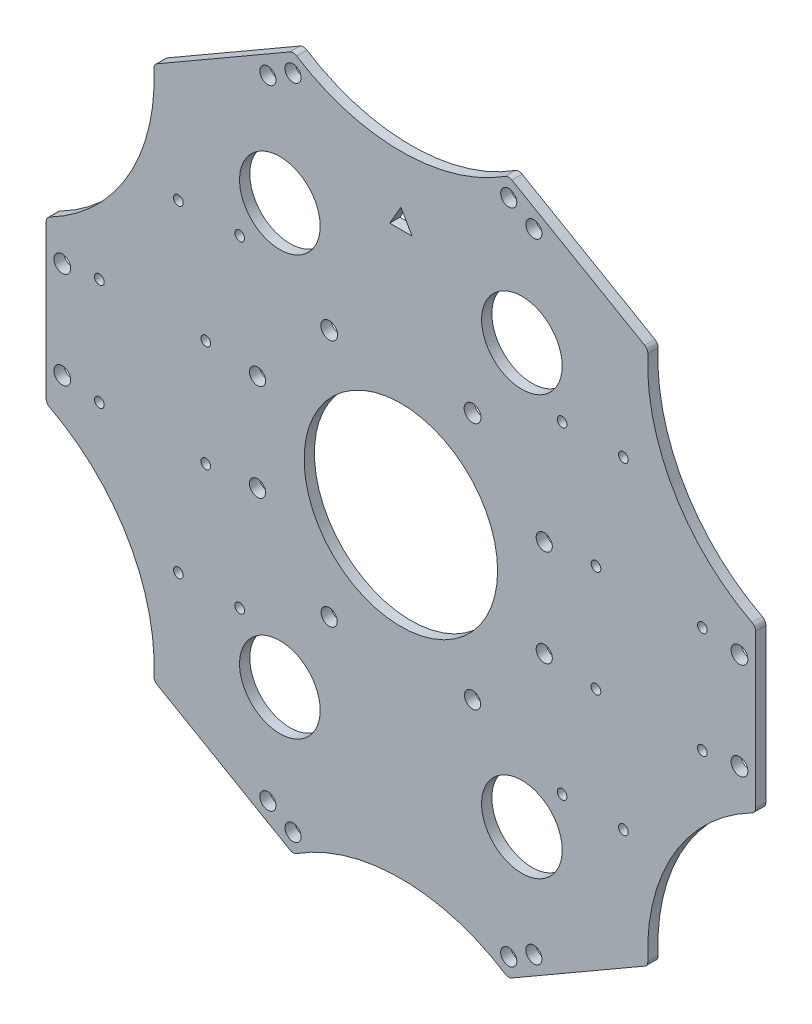
from build123d import *

# Parameters (mm, degrees)
SKETCH1_R           = 2.5
SKETCH1_R_2         = 2.6
SKETCH1_R_3         = 1.5
SKETCH1_R_4         = 12.5
SKETCH1_R_5         = 30
BOSS_EXTRUDE1_DEPTH = 3.175
FILLET1_R           = 2
SKETCH3_R           = 1.5
CUT_EXTRUDE1_DEPTH  = 4


with BuildPart() as part:
    # Sketch1 → Boss-Extrude1 (new body)
    with BuildSketch(Plane.XY):
        with BuildLine():
            Line((-120, -25), (-120, 25))
            ThreePointArc((-120, 25), (-94.559451613, 48.820422151), (-86.650635095, 82.762794416))
            Line((-86.650635095, 82.762794416), (-43.349364905, 107.762794416))
            ThreePointArc((-43.349364905, 107.762794416), (-10, 97.640844302), (23.349364905, 107.762794416))
            Line((23.349364905, 107.762794416), (66.650635095, 82.762794416))
            ThreePointArc((66.650635095, 82.762794416), (74.559451613, 48.820422151), (100, 25))
            Line((100, 25), (100, -25))
            ThreePointArc((100, -25), (74.559451613, -48.820422151), (66.650635095, -82.762794416))
            Line((66.650635095, -82.762794416), (23.349364905, -107.762794416))
            ThreePointArc((23.349364905, -107.762794416), (-10, -97.640844302), (-43.349364905, -107.762794416))
            Line((-43.349364905, -107.762794416), (-86.650635095, -82.762794416))
            ThreePointArc((-86.650635095, -82.762794416), (-94.559451613, -48.820422151), (-120, -25))
        make_face()
        with Locations((12.227985364, -38.5)):
            Circle(SKETCH1_R, mode=Mode.SUBTRACT)
        with Locations((-54.455970728, 15)):
            Circle(SKETCH1_R, mode=Mode.SUBTRACT)
        with Locations((12.227985364, 38.5)):
            Circle(SKETCH1_R_2, mode=Mode.SUBTRACT)
        with Locations((-32.227985364, 38.5)):
            Circle(SKETCH1_R_2, mode=Mode.SUBTRACT)
        with Locations((-54.455970728, -15)):
            Circle(SKETCH1_R, mode=Mode.SUBTRACT)
        with Locations((-32.227985364, -38.5)):
            Circle(SKETCH1_R, mode=Mode.SUBTRACT)
        with Locations((95, 15)):
            Circle(SKETCH1_R_2, mode=Mode.SUBTRACT)
        with Locations((95, -15)):
            Circle(SKETCH1_R_2, mode=Mode.SUBTRACT)
        with Locations((-115, -15)):
            Circle(SKETCH1_R_2, mode=Mode.SUBTRACT)
        with Locations((-115, 15)):
            Circle(SKETCH1_R_2, mode=Mode.SUBTRACT)
        with Locations((31.241669751, -97.432667397)):
            Circle(SKETCH1_R, mode=Mode.SUBTRACT)
        with Locations((23.447441117, -101.932667397)):
            Circle(SKETCH1_R, mode=Mode.SUBTRACT)
        with Locations((-43.447441117, -101.932667397)):
            Circle(SKETCH1_R, mode=Mode.SUBTRACT)
        with Locations((-51.241669751, -97.432667397)):
            Circle(SKETCH1_R, mode=Mode.SUBTRACT)
        with Locations((-51.241669751, 97.432667397)):
            Circle(SKETCH1_R, mode=Mode.SUBTRACT)
        with Locations((-43.447441117, 101.932667397)):
            Circle(SKETCH1_R, mode=Mode.SUBTRACT)
        with Locations((23.447441117, 101.932667397)):
            Circle(SKETCH1_R, mode=Mode.SUBTRACT)
        with Locations((31.241669751, 97.432667397)):
            Circle(SKETCH1_R, mode=Mode.SUBTRACT)
        with Locations((34.455970728, -15)):
            Circle(SKETCH1_R, mode=Mode.SUBTRACT)
        with Locations((34.455970728, 15)):
            Circle(SKETCH1_R, mode=Mode.SUBTRACT)
        with Locations((-79, 50)):
            Circle(SKETCH1_R_3, mode=Mode.SUBTRACT)
        with Locations((-60, 50)):
            Circle(SKETCH1_R_3, mode=Mode.SUBTRACT)
        with Locations((-60, -50)):
            Circle(SKETCH1_R_3, mode=Mode.SUBTRACT)
        with Locations((-79, -50)):
            Circle(SKETCH1_R_3, mode=Mode.SUBTRACT)
        with Locations((40, -50)):
            Circle(SKETCH1_R_3, mode=Mode.SUBTRACT)
        with Locations((59, -50)):
            Circle(SKETCH1_R_3, mode=Mode.SUBTRACT)
        with Locations((59, 50)):
            Circle(SKETCH1_R_3, mode=Mode.SUBTRACT)
        with Locations((40, 50)):
            Circle(SKETCH1_R_3, mode=Mode.SUBTRACT)
        with Locations((27.527767497, -65)):
            Circle(SKETCH1_R_4, mode=Mode.SUBTRACT)
        with Locations((-10, 0)):
            Circle(SKETCH1_R_5, mode=Mode.SUBTRACT)
        with Locations((-47.527767497, -65)):
            Circle(SKETCH1_R_4, mode=Mode.SUBTRACT)
        with Locations((-47.527767497, 65)):
            Circle(SKETCH1_R_4, mode=Mode.SUBTRACT)
        with Locations((27.527767497, 65)):
            Circle(SKETCH1_R_4, mode=Mode.SUBTRACT)
        Polygon((-10, 82.640844302), (-13.464101615, 76.640844302), (-6.535898385, 76.640844302), align=None, mode=Mode.SUBTRACT)
    extrude(amount=BOSS_EXTRUDE1_DEPTH)

    # Fillet1
    fillet1_edges = [part.edges().sort_by_distance(p)[0] for p in [
        (-120, -25, 1.5875),
        (-120, 25, 1.5875),
        (-86.650635095, 82.762794416, 1.5875),
        (-43.349364905, 107.762794416, 1.5875),
        (23.349364905, 107.762794416, 1.5875),
        (66.650635095, 82.762794416, 1.5875),
        (100, 25, 1.5875),
        (100, -25, 1.5875),
        (66.650635095, -82.762794416, 1.5875),
        (23.349364905, -107.762794416, 1.5875),
        (-43.349364905, -107.762794416, 1.5875),
        (-86.650635095, -82.762794416, 1.5875),
    ]]
    fillet(fillet1_edges, radius=FILLET1_R)

    # Sketch3 → Cut-Extrude1 (cut)
    with BuildSketch(Plane.XY.offset(3.175)):
        with Locations((-103.5, 16.5)):
            Circle(SKETCH3_R)
        with Locations((-70.5, 16.5)):
            Circle(SKETCH3_R)
        with Locations((-70.5, -16.5)):
            Circle(SKETCH3_R)
        with Locations((-103.5, -16.5)):
            Circle(SKETCH3_R)
        with Locations((50.5, -16.5)):
            Circle(SKETCH3_R)
        with Locations((83.5, -16.5)):
            Circle(SKETCH3_R)
        with Locations((50.5, 16.5)):
            Circle(SKETCH3_R)
        with Locations((83.5, 16.5)):
            Circle(SKETCH3_R)
    extrude(amount=-CUT_EXTRUDE1_DEPTH, mode=Mode.SUBTRACT)


solid = part.part
